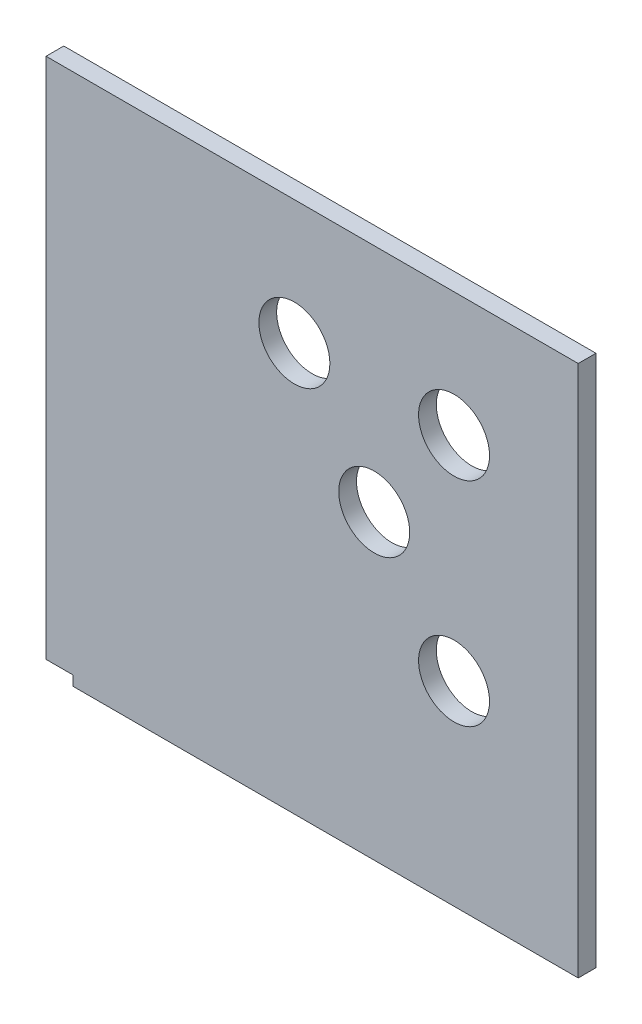
from build123d import *

# Parameters (mm, degrees)
SKETCH_1_W          = 300
SKETCH_1_H          = 300
EXTRUDE_1_DEPTH     = 10
SKETCH_2_R          = 20
CUT_EXTRUDE_1_DEPTH = 213.367605816
SKETCH_3_R          = 20
CUT_EXTRUDE_2_DEPTH = 10
SKETCH_4_W          = 35.387588736
SKETCH_4_H          = 35.350682188
CUT_EXTRUDE_3_DEPTH = 25
SKETCH_5_W          = 15.318794368
SKETCH_5_H          = 10
EXTRUDE_2_DEPTH     = 24.5


with BuildPart() as part:
    # 草图1 → 凸台-拉伸1 (new body)
    with BuildSketch(Plane.XY):
        Rectangle(SKETCH_1_W, SKETCH_1_H)
    extrude(amount=EXTRUDE_1_DEPTH)

    # 草图2 → 切除-拉伸1 (cut, through all)
    with BuildSketch(Plane.XY.offset(10)):
        with Locations((35, 20)):
            Circle(SKETCH_2_R)
    extrude(amount=-CUT_EXTRUDE_1_DEPTH, mode=Mode.SUBTRACT)

    # 草图3 → 切除-拉伸2 (cut)
    with BuildSketch(Plane.XY):
        with Locations((80, 80)):
            Circle(SKETCH_3_R)
        with Locations((80, -40)):
            Circle(SKETCH_3_R)
        with Locations((-10, 80)):
            Circle(SKETCH_3_R)
    extrude(amount=CUT_EXTRUDE_2_DEPTH, mode=Mode.SUBTRACT)

    # 草图4 → 切除-拉伸3 (cut)
    with BuildSketch(Plane.XY.offset(10)):
        with Locations((-152.375, -137.625)):
            Rectangle(SKETCH_4_W, SKETCH_4_H)
    extrude(amount=-CUT_EXTRUDE_3_DEPTH, mode=Mode.SUBTRACT)

    # 草图5 → 凸台-拉伸2 (add)
    with BuildSketch(Plane.XZ.offset(119.949658906)):
        with Locations((-142.340602816, 5)):
            Rectangle(SKETCH_5_W, SKETCH_5_H)
    extrude(amount=EXTRUDE_2_DEPTH)


solid = part.part
